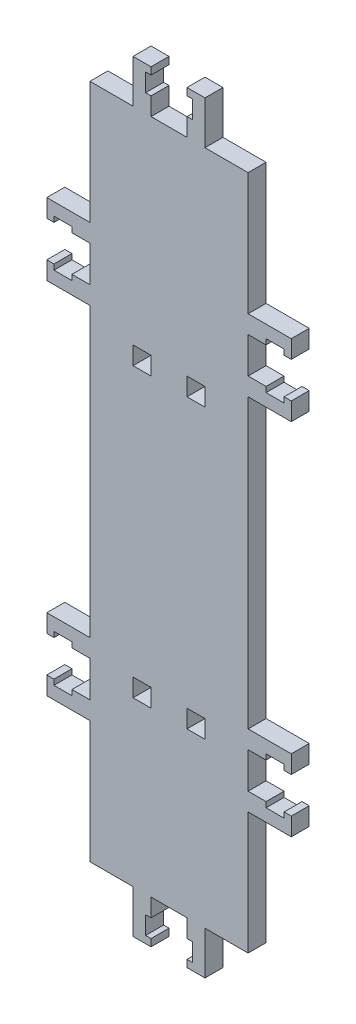
from build123d import *

# Parameters (mm, degrees)
ESQUISSE1_W        = 5
ESQUISSE1_H        = 5
BOSS_EXTRU_1_DEPTH = 5


with BuildPart() as part:
    # Esquisse1 → Boss.-Extru.1 (new body)
    with BuildSketch(Plane.XY):
        Polygon((-10, 188), (-22, 188), (-22, 154), (-34, 154), (-34, 149), (-32, 149), (-32, 150.5), (-27, 150.5), (-27, 149), (-22, 149), (-22, 139), (-27, 139), (-27, 137.5), (-32, 137.5), (-32, 139), (-34, 139), (-34, 134), (-22, 134), (-22, 54), (-34, 54), (-34, 49), (-32, 49), (-32, 50.5), (-27, 50.5), (-27, 49), (-22, 49), (-22, 39), (-27, 39), (-27, 37.5), (-32, 37.5), (-32, 39), (-34, 39), (-34, 34), (-22, 34), (-22, 0), (-10, 0), (-10, -12), (-5, -12), (-5, -10), (-6.5, -10), (-6.5, -5), (-5, -5), (-5, 0), (5, 0), (5, -5), (6.5, -5), (6.5, -10), (5, -10), (5, -12), (10, -12), (10, 0), (22, 0), (22, 34), (34, 34), (34, 39), (32, 39), (32, 37.5), (27, 37.5), (27, 39), (22, 39), (22, 49), (27, 49), (27, 50.5), (32, 50.5), (32, 49), (34, 49), (34, 54), (22, 54), (22, 134), (34, 134), (34, 139), (32, 139), (32, 137.5), (27, 137.5), (27, 139), (22, 139), (22, 149), (27, 149), (27, 150.5), (32, 150.5), (32, 149), (34, 149), (34, 154), (22, 154), (22, 188), (10, 188), (10, 200), (5, 200), (5, 198), (6.5, 198), (6.5, 193), (5, 193), (5, 188), (-5, 188), (-5, 193), (-6.5, 193), (-6.5, 198), (-5, 198), (-5, 200), (-10, 200), align=None)
        with Locations((-7.5, 48)):
            Rectangle(ESQUISSE1_W, ESQUISSE1_H, mode=Mode.SUBTRACT)
        with Locations((7.5, 48)):
            Rectangle(ESQUISSE1_W, ESQUISSE1_H, mode=Mode.SUBTRACT)
        with Locations((-7.5, 128)):
            Rectangle(ESQUISSE1_W, ESQUISSE1_H, mode=Mode.SUBTRACT)
        with Locations((7.5, 128)):
            Rectangle(ESQUISSE1_W, ESQUISSE1_H, mode=Mode.SUBTRACT)
    extrude(amount=BOSS_EXTRU_1_DEPTH)


solid = part.part
